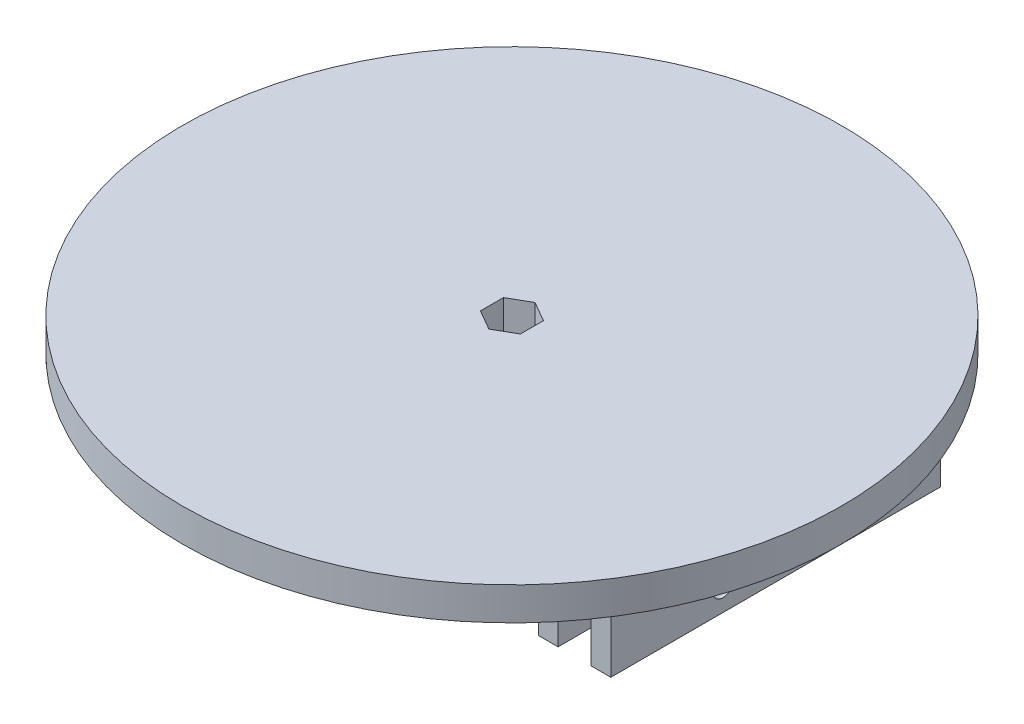
from build123d import *

# Parameters (mm, degrees)
SKETCH2_R               = 9
BOSS_EXTRUDE1_DEPTH     = 20
CUT_EXTRUDE1_DEPTH      = 20
SKETCH4_R               = 50
SKETCH4_R_2             = 4.5
BOSS_EXTRUDE3_DEPTH     = 5
CUT_EXTRUDE2_DEPTH      = 9
CUT_EXTRUDE2_DEPTH_BACK = 9
SKETCH11_R              = 1.55
CUT_EXTRUDE9_DEPTH      = 9
CUT_EXTRUDE9_DEPTH_BACK = 9
SKETCH15_R              = 1.55
SKETCH16_W              = 3
SKETCH16_H              = 50
BOSS_EXTRUDE4_DEPTH     = 10
CUT_EXTRUDE10_REACH     = 106.881
SKETCH17_R              = 1.55
CUT_EXTRUDE11_START     = -11
SKETCH18_R              = 1.55
CUT_EXTRUDE11_DEPTH     = 11
CUT_EXTRUDE14_START     = 9
SKETCH19_R              = 3.5
CUT_EXTRUDE14_DEPTH     = 3
CUT_EXTRUDE15_START     = -6
SKETCH19_3_R            = 3.5
CUT_EXTRUDE15_DEPTH     = 3
CUT_EXTRUDE16_START     = 9
SKETCH20_R              = 3.5
CUT_EXTRUDE16_DEPTH     = 3
CUT_EXTRUDE17_START     = -6
SKETCH20_2_R            = 3.5
CUT_EXTRUDE17_DEPTH     = 3


with BuildPart() as part:
    # Sketch2 → Boss-Extrude1 (new body)
    with BuildSketch(Plane(origin=(0, 0, 0), x_dir=(1, 0, 0), z_dir=(0, 1, 0))):
        with Locations(Location((0, 0, 0), (0, 0, 270))):
            Circle(SKETCH2_R)
    extrude(amount=BOSS_EXTRUDE1_DEPTH)

    # Sketch3 → Cut-Extrude1 (cut)
    with BuildSketch(Plane(origin=(0, 20, 0), x_dir=(1, 0, 0), z_dir=(0, 1, 0))):
        Polygon((0, 3.5), (-3.031088913, 1.75), (-3.031088913, -1.75), (0, -3.5), (3.031088913, -1.75), (3.031088913, 1.75), align=None)
    extrude(amount=-CUT_EXTRUDE1_DEPTH, mode=Mode.SUBTRACT)

    # Sketch4 → Boss-Extrude3 (add)
    with BuildSketch(Plane(origin=(0, 20, 0), x_dir=(1, 0, 0), z_dir=(0, 1, 0))):
        with Locations(Location((0, 0, 0), (0, 0, 270))):
            Circle(SKETCH4_R)
        Circle(SKETCH4_R_2, mode=Mode.SUBTRACT)
    extrude(amount=-BOSS_EXTRUDE3_DEPTH)

    # Sketch11 → Cut-Extrude2 (cut, two sides: drawn at the far end of the back side and taken through both)
    with BuildSketch(Plane(origin=(0, 0, 0), x_dir=(-0.8660254037844387, 0, -0.49999999999999983), z_dir=(0.49999999999999983, 0, -0.8660254037844387)).offset(-CUT_EXTRUDE2_DEPTH_BACK)):
        with Locations(Location((0, 5, 0), (0, 0, 180))):
            Circle(SKETCH11_R)
    extrude(amount=CUT_EXTRUDE2_DEPTH + CUT_EXTRUDE2_DEPTH_BACK, mode=Mode.SUBTRACT)

    # Sketch15 → Cut-Extrude9 (cut, two sides: drawn at the far end of the back side and taken through both)
    with BuildSketch(Plane(origin=(0, 0, 0), x_dir=(-0.866025403784439, 0, 0.49999999999999944), z_dir=(-0.49999999999999944, 0, -0.866025403784439)).offset(-CUT_EXTRUDE9_DEPTH_BACK)):
        with Locations(Location((0, 9, 0), (0, 0, 270))):
            Circle(SKETCH15_R)
    extrude(amount=CUT_EXTRUDE9_DEPTH + CUT_EXTRUDE9_DEPTH_BACK, mode=Mode.SUBTRACT)

    # Sketch16 → Boss-Extrude4 (add)
    with BuildSketch(Plane.XZ.offset(-15)):
        with Locations((-30.5, 0)):
            Rectangle(SKETCH16_W, SKETCH16_H)
        with Locations((-38.5, 0)):
            Rectangle(SKETCH16_W, SKETCH16_H)
        with Locations((30.5, 0)):
            Rectangle(SKETCH16_W, SKETCH16_H)
        with Locations((38.5, 0)):
            Rectangle(SKETCH16_W, SKETCH16_H)
    extrude(amount=BOSS_EXTRUDE4_DEPTH)

    # Cut-Extrude10: up to this face of the body (flat: up to its plane)
    cut_extrude10_end = Plane(part.part.faces().sort_by_distance((-29, 10, 0))[0])
    # Sketch17 → Cut-Extrude10 (cut, up to the picked face)
    with BuildSketch(Plane.ZY.offset(40), mode=Mode.PRIVATE) as cut_extrude10_sk1:
        with Locations((-16, 11.5)):
            Circle(SKETCH17_R)
    cut_extrude10_tool1 = split(extrude(cut_extrude10_sk1.sketch, amount=-CUT_EXTRUDE10_REACH, mode=Mode.PRIVATE), bisect_by=cut_extrude10_end, keep=Keep.BOTH, mode=Mode.PRIVATE)
    # Sketch17 → Cut-Extrude10 (cut, up to the picked face)
    with BuildSketch(Plane.ZY.offset(40), mode=Mode.PRIVATE) as cut_extrude10_sk2:
        with Locations((-8, 8.5)):
            Circle(SKETCH17_R)
    cut_extrude10_tool2 = split(extrude(cut_extrude10_sk2.sketch, amount=-CUT_EXTRUDE10_REACH, mode=Mode.PRIVATE), bisect_by=cut_extrude10_end, keep=Keep.BOTH, mode=Mode.PRIVATE)
    # Sketch17 → Cut-Extrude10 (cut, up to the picked face)
    with BuildSketch(Plane.ZY.offset(40), mode=Mode.PRIVATE) as cut_extrude10_sk3:
        with Locations((8, 8.5)):
            Circle(SKETCH17_R)
    cut_extrude10_tool3 = split(extrude(cut_extrude10_sk3.sketch, amount=-CUT_EXTRUDE10_REACH, mode=Mode.PRIVATE), bisect_by=cut_extrude10_end, keep=Keep.BOTH, mode=Mode.PRIVATE)
    # Sketch17 → Cut-Extrude10 (cut, up to the picked face)
    with BuildSketch(Plane.ZY.offset(40), mode=Mode.PRIVATE) as cut_extrude10_sk4:
        with Locations((16, 11.5)):
            Circle(SKETCH17_R)
    cut_extrude10_tool4 = split(extrude(cut_extrude10_sk4.sketch, amount=-CUT_EXTRUDE10_REACH, mode=Mode.PRIVATE), bisect_by=cut_extrude10_end, keep=Keep.BOTH, mode=Mode.PRIVATE)
    add(cut_extrude10_tool1.solids().sort_by(Axis((-40, 11.5, -16), (1, 0, 0)))[0], mode=Mode.SUBTRACT)
    add(cut_extrude10_tool2.solids().sort_by(Axis((-40, 8.5, -8), (1, 0, 0)))[0], mode=Mode.SUBTRACT)
    add(cut_extrude10_tool3.solids().sort_by(Axis((-40, 8.5, 8), (1, 0, 0)))[0], mode=Mode.SUBTRACT)
    add(cut_extrude10_tool4.solids().sort_by(Axis((-40, 11.5, 16), (1, 0, 0)))[0], mode=Mode.SUBTRACT)

    # Sketch18 → Cut-Extrude11 (cut)
    with BuildSketch(Plane(origin=(40, 0, 0), x_dir=(0, 0, -1), z_dir=(1, 0, 0)).offset(CUT_EXTRUDE11_START)):
        with Locations(Location((-8, 8.5, 0), (0, 0, 180))):
            Circle(SKETCH18_R)
        with Locations(Location((8, 8.5, 0), (0, 0, 180))):
            Circle(SKETCH18_R)
        with Locations(Location((16, 11.5, 0), (0, 0, 180))):
            Circle(SKETCH18_R)
        with Locations(Location((-16, 11.5, 0), (0, 0, 180))):
            Circle(SKETCH18_R)
    extrude(amount=CUT_EXTRUDE11_DEPTH, mode=Mode.SUBTRACT)

    # Sketch19 → Cut-Extrude14 (cut)
    with BuildSketch(Plane(origin=(0, 0, 0), x_dir=(-0.866025403784439, 0, 0.49999999999999944), z_dir=(-0.49999999999999944, 0, -0.866025403784439)).offset(CUT_EXTRUDE14_START)):
        with Locations((0, 9)):
            Circle(SKETCH19_R)
    extrude(amount=-CUT_EXTRUDE14_DEPTH, mode=Mode.SUBTRACT)

    # Sketch19<3> → Cut-Extrude15 (cut)
    with BuildSketch(Plane(origin=(0, 0, 0), x_dir=(-0.866025403784439, 0, 0.49999999999999944), z_dir=(-0.49999999999999944, 0, -0.866025403784439)).offset(CUT_EXTRUDE15_START)):
        with Locations((0, 9)):
            Circle(SKETCH19_3_R)
    extrude(amount=-CUT_EXTRUDE15_DEPTH, mode=Mode.SUBTRACT)

    # Sketch20 → Cut-Extrude16 (cut)
    with BuildSketch(Plane(origin=(0, 0, 0), x_dir=(-0.8660254037844387, 0, -0.49999999999999983), z_dir=(0.49999999999999983, 0, -0.8660254037844387)).offset(CUT_EXTRUDE16_START)):
        with Locations((0, 5)):
            Circle(SKETCH20_R)
    extrude(amount=-CUT_EXTRUDE16_DEPTH, mode=Mode.SUBTRACT)

    # Sketch20<2> → Cut-Extrude17 (cut)
    with BuildSketch(Plane(origin=(0, 0, 0), x_dir=(-0.8660254037844387, 0, -0.49999999999999983), z_dir=(0.49999999999999983, 0, -0.8660254037844387)).offset(CUT_EXTRUDE17_START)):
        with Locations((0, 5)):
            Circle(SKETCH20_2_R)
    extrude(amount=-CUT_EXTRUDE17_DEPTH, mode=Mode.SUBTRACT)


solid = part.part
